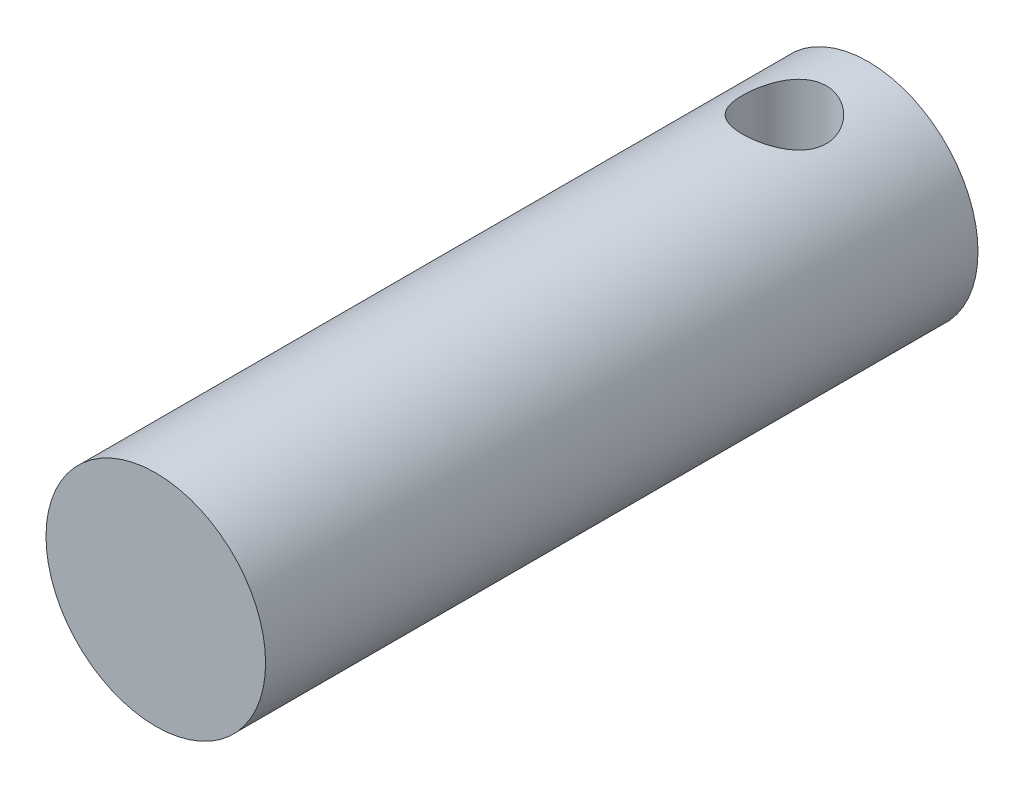
from build123d import *

# Parameters (mm, degrees)
SKETCH1_R               = 2.62
BOSS_EXTRUDE1_DEPTH     = 17
CUT_EXTRUDE1_DEPTH      = 10
CUT_EXTRUDE1_DEPTH_BACK = 10
SKETCH2_R               = 1


with BuildPart() as part:
    # Sketch1 → Boss-Extrude1 (new body)
    with BuildSketch(Plane.XY):
        Circle(SKETCH1_R)
    extrude(amount=BOSS_EXTRUDE1_DEPTH)

    # Sketch2 → Cut-Extrude1 (cut, two sides: drawn at the far end of the back side and taken through both)
    with BuildSketch(Plane(origin=(0, 0, 0), x_dir=(1, 0, 0), z_dir=(0, 1, 0)).offset(-CUT_EXTRUDE1_DEPTH_BACK)):
        with Locations((0, -2)):
            Circle(SKETCH2_R)
    extrude(amount=CUT_EXTRUDE1_DEPTH + CUT_EXTRUDE1_DEPTH_BACK, mode=Mode.SUBTRACT)


solid = part.part
